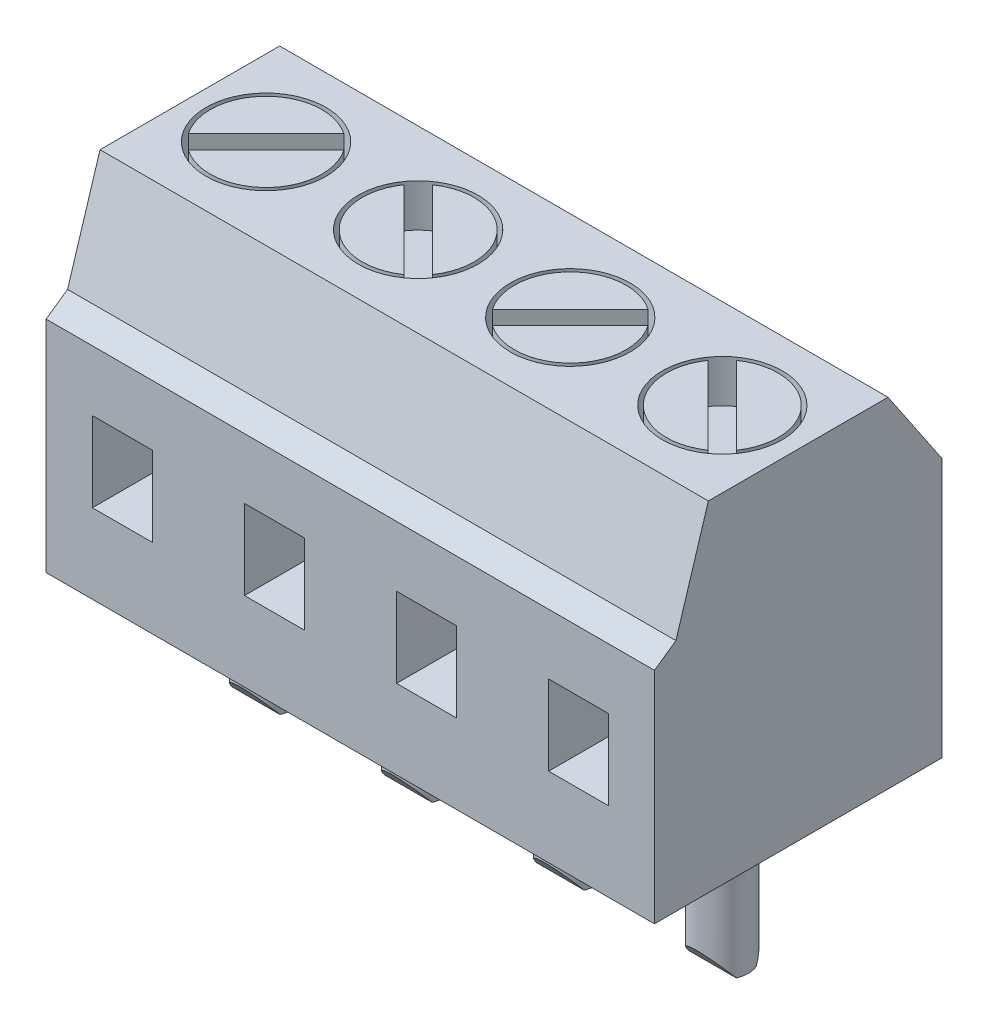
from build123d import *

# Parameters (mm, degrees)
SKETCH3_W                    = 15.24
SKETCH3_H                    = 7.2
BOSS_EXTRUDE1_DEPTH          = 8.5
SKETCH4_R                    = 0.65
BOSS_EXTRUDE2_DEPTH          = 3.5
CUT_EXTRUDE1_REACH           = 20.877
CUT_EXTRUDE3_DEPTH           = 15.24
SKETCH13_W                   = 1.5
SKETCH13_H                   = 2
CUT_EXTRUDE4_DEPTH           = 2
CUT_EXTRUDE4_DRAFT           = -6
CUT_EXTRUDE4_PROFILE_2_DEPTH = 2
CUT_EXTRUDE4_PROFILE_2_DRAFT = -6
CUT_EXTRUDE4_PROFILE_3_DEPTH = 2
CUT_EXTRUDE4_PROFILE_3_DRAFT = -6
CUT_EXTRUDE4_PROFILE_4_DEPTH = 2
CUT_EXTRUDE4_PROFILE_4_DRAFT = -6
SKETCH14_R                   = 1.5
SKETCH14_R_2                 = 1.4
CUT_EXTRUDE5_DEPTH           = 2
CUT_EXTRUDE6_DEPTH           = 1


with BuildPart() as part:
    # Sketch3 → Boss-Extrude1 (new body)
    with BuildSketch(Plane(origin=(0, 0, 0), x_dir=(1, 0, 0), z_dir=(0, 1, 0))):
        with Locations((7.62, 3.6)):
            Rectangle(SKETCH3_W, SKETCH3_H)
    extrude(amount=BOSS_EXTRUDE1_DEPTH)

    # Sketch4 → Boss-Extrude2 (add)
    with BuildSketch(Plane(origin=(0, 0, 0), x_dir=(-1, 0, 0), z_dir=(0, -1, 0))):
        with Locations(Location((-1.91, 3.6, 0), (0, 0, 90))):
            Circle(SKETCH4_R)
        with Locations(Location((-5.72, 3.6, 0), (0, 0, 90))):
            Circle(SKETCH4_R)
        with Locations(Location((-9.53, 3.6, 0), (0, 0, 90))):
            Circle(SKETCH4_R)
        with Locations(Location((-13.34, 3.6, 0), (0, 0, 90))):
            Circle(SKETCH4_R)
    extrude(amount=BOSS_EXTRUDE2_DEPTH)

    # Cut-Extrude1: up to this face of the body (flat: up to its plane)
    cut_extrude1_end = Plane(part.part.faces().sort_by_distance((15.24, 4.25, -3.6))[0])
    # Sketch5 → Cut-Extrude1 (cut, up to the picked face)
    with BuildSketch(Plane.ZY, mode=Mode.PRIVATE) as cut_extrude1_sk1:
        Polygon((-2.95, -3), (-2.95, -3.5), (-3.35, -3.5), align=None)
    cut_extrude1_tool1 = split(extrude(cut_extrude1_sk1.sketch, amount=-CUT_EXTRUDE1_REACH, mode=Mode.PRIVATE), bisect_by=cut_extrude1_end, keep=Keep.BOTH, mode=Mode.PRIVATE)
    # Sketch5 → Cut-Extrude1 (cut, up to the picked face)
    with BuildSketch(Plane.ZY, mode=Mode.PRIVATE) as cut_extrude1_sk2:
        Polygon((-4.25, -3), (-3.85, -3.5), (-4.25, -3.5), align=None)
    cut_extrude1_tool2 = split(extrude(cut_extrude1_sk2.sketch, amount=-CUT_EXTRUDE1_REACH, mode=Mode.PRIVATE), bisect_by=cut_extrude1_end, keep=Keep.BOTH, mode=Mode.PRIVATE)
    add(cut_extrude1_tool1.solids().sort_by(Axis((0, -3.333333, -3.083333), (1, 0, 0)))[0], mode=Mode.SUBTRACT)
    add(cut_extrude1_tool2.solids().sort_by(Axis((0, -3.333333, -4.116667), (1, 0, 0)))[0], mode=Mode.SUBTRACT)

    # Sketch8 → Cut-Extrude3 (cut)
    with BuildSketch(Plane(origin=(15.24, 0, 0), x_dir=(0, 0, -1), z_dir=(1, 0, 0))):
        Polygon((0, 5.5), (0.537301365, 5.876222466), (1.35, 8.5), (0, 8.5), align=None)
        Polygon((7.2, 6.5), (5.85, 8.5), (7.2, 8.5), align=None)
    extrude(amount=-CUT_EXTRUDE3_DEPTH, mode=Mode.SUBTRACT)


with BuildPart() as cut_extrude4_tool:
    # Sketch13 → Cut-Extrude4 (with draft: the straight prism first)
    with BuildSketch(Plane.XY):
        with Locations((13.34, 2.98672158)):
            Rectangle(SKETCH13_W, SKETCH13_H)
    extrude(amount=-CUT_EXTRUDE4_DEPTH)
    # Cut-Extrude4: the draft: its side faces are tilted about the plane it starts from
    cut_extrude4_sides = [cut_extrude4_tool.faces().sort_by_distance(p)[0] for p in [
        (13.34, 1.98672158, -1),
        (14.09, 2.98672158, -1),
        (13.34, 3.98672158, -1),
        (12.59, 2.98672158, -1),
    ]]
    draft(cut_extrude4_sides, Plane.XY, CUT_EXTRUDE4_DRAFT)


with BuildPart() as part_1:
    add(part.part)

    # Cut-Extrude4: cut by cut_extrude4_tool
    add(cut_extrude4_tool.part, mode=Mode.SUBTRACT)


with BuildPart() as cut_extrude4_profile_2_tool:
    # Sketch13 → Cut-Extrude4 profile 2 (with draft: the straight prism first)
    with BuildSketch(Plane.XY):
        with Locations((9.53, 2.98672158)):
            Rectangle(SKETCH13_W, SKETCH13_H)
    extrude(amount=-CUT_EXTRUDE4_PROFILE_2_DEPTH)
    # Cut-Extrude4 profile 2: the draft: its side faces are tilted about the plane it starts from
    cut_extrude4_profile_2_sides = [cut_extrude4_profile_2_tool.faces().sort_by_distance(p)[0] for p in [
        (9.53, 1.98672158, -1),
        (10.28, 2.98672158, -1),
        (9.53, 3.98672158, -1),
        (8.78, 2.98672158, -1),
    ]]
    draft(cut_extrude4_profile_2_sides, Plane.XY, CUT_EXTRUDE4_PROFILE_2_DRAFT)


with BuildPart() as part_2:
    add(part_1.part)

    # Cut-Extrude4 profile 2: cut by cut_extrude4_profile_2_tool
    add(cut_extrude4_profile_2_tool.part, mode=Mode.SUBTRACT)


with BuildPart() as cut_extrude4_profile_3_tool:
    # Sketch13 → Cut-Extrude4 profile 3 (with draft: the straight prism first)
    with BuildSketch(Plane.XY):
        with Locations((5.72, 2.98672158)):
            Rectangle(SKETCH13_W, SKETCH13_H)
    extrude(amount=-CUT_EXTRUDE4_PROFILE_3_DEPTH)
    # Cut-Extrude4 profile 3: the draft: its side faces are tilted about the plane it starts from
    cut_extrude4_profile_3_sides = [cut_extrude4_profile_3_tool.faces().sort_by_distance(p)[0] for p in [
        (5.72, 1.98672158, -1),
        (6.47, 2.98672158, -1),
        (5.72, 3.98672158, -1),
        (4.97, 2.98672158, -1),
    ]]
    draft(cut_extrude4_profile_3_sides, Plane.XY, CUT_EXTRUDE4_PROFILE_3_DRAFT)


with BuildPart() as part_3:
    add(part_2.part)

    # Cut-Extrude4 profile 3: cut by cut_extrude4_profile_3_tool
    add(cut_extrude4_profile_3_tool.part, mode=Mode.SUBTRACT)


with BuildPart() as cut_extrude4_profile_4_tool:
    # Sketch13 → Cut-Extrude4 profile 4 (with draft: the straight prism first)
    with BuildSketch(Plane.XY):
        with Locations((1.91, 2.98672158)):
            Rectangle(SKETCH13_W, SKETCH13_H)
    extrude(amount=-CUT_EXTRUDE4_PROFILE_4_DEPTH)
    # Cut-Extrude4 profile 4: the draft: its side faces are tilted about the plane it starts from
    cut_extrude4_profile_4_sides = [cut_extrude4_profile_4_tool.faces().sort_by_distance(p)[0] for p in [
        (1.91, 1.98672158, -1),
        (2.66, 2.98672158, -1),
        (1.91, 3.98672158, -1),
        (1.16, 2.98672158, -1),
    ]]
    draft(cut_extrude4_profile_4_sides, Plane.XY, CUT_EXTRUDE4_PROFILE_4_DRAFT)


with BuildPart() as part_4:
    add(part_3.part)

    # Cut-Extrude4 profile 4: cut by cut_extrude4_profile_4_tool
    add(cut_extrude4_profile_4_tool.part, mode=Mode.SUBTRACT)

    # Sketch14 → Cut-Extrude5 (cut)
    # profile 1 of 4: a face of its own
    with BuildSketch(Plane(origin=(0, 8.5, 0), x_dir=(1, 0, 0), z_dir=(0, 1, 0))):
        with Locations(Location((1.91, 3.6, 0), (0, 0, 270))):
            Circle(SKETCH14_R)
        with Locations(Location((1.91, 3.6, 0), (0, 0, 270))):
            Circle(SKETCH14_R_2, mode=Mode.SUBTRACT)
    # profile 2 of 4: a face of its own
    with BuildSketch(Plane(origin=(0, 8.5, 0), x_dir=(1, 0, 0), z_dir=(0, 1, 0))):
        with Locations(Location((5.72, 3.6, 0), (0, 0, 270))):
            Circle(SKETCH14_R)
        with Locations(Location((5.72, 3.6, 0), (0, 0, 270))):
            Circle(SKETCH14_R_2, mode=Mode.SUBTRACT)
    # profile 3 of 4: a face of its own
    with BuildSketch(Plane(origin=(0, 8.5, 0), x_dir=(1, 0, 0), z_dir=(0, 1, 0))):
        with Locations(Location((9.53, 3.6, 0), (0, 0, 270))):
            Circle(SKETCH14_R)
        with Locations(Location((9.53, 3.6, 0), (0, 0, 270))):
            Circle(SKETCH14_R_2, mode=Mode.SUBTRACT)
    # profile 4 of 4: a face of its own
    with BuildSketch(Plane(origin=(0, 8.5, 0), x_dir=(1, 0, 0), z_dir=(0, 1, 0))):
        with Locations(Location((13.34, 3.6, 0), (0, 0, 270))):
            Circle(SKETCH14_R)
        with Locations(Location((13.34, 3.6, 0), (0, 0, 270))):
            Circle(SKETCH14_R_2, mode=Mode.SUBTRACT)
    extrude(amount=-CUT_EXTRUDE5_DEPTH, mode=Mode.SUBTRACT)

    # Sketch15 → Cut-Extrude6 (cut)
    with BuildSketch(Plane(origin=(0, 8.5, 0), x_dir=(1, 0, 0), z_dir=(0, 1, 0))):
        with BuildLine():
            Line((1.102525711, 2.43897232), (3.07102768, 4.407474289))
            ThreePointArc((3.07102768, 4.407474289), (2.91, 4.6), (2.717474289, 4.76102768))
            Line((2.717474289, 4.76102768), (0.74897232, 2.792525711))
            ThreePointArc((0.74897232, 2.792525711), (0.91, 2.6), (1.102525711, 2.43897232))
        make_face()
        with BuildLine():
            Line((8.732738708, 2.449185318), (10.680814682, 4.397261292))
            ThreePointArc((10.680814682, 4.397261292), (10.519949494, 4.589949494), (10.327261292, 4.750814682))
            Line((10.327261292, 4.750814682), (8.379185318, 2.802738708))
            ThreePointArc((8.379185318, 2.802738708), (8.540050506, 2.610050506), (8.732738708, 2.449185318))
        make_face()
        with BuildLine():
            Line((6.870814682, 2.802738708), (4.922738708, 4.750814682))
            ThreePointArc((4.922738708, 4.750814682), (4.730050506, 4.589949494), (4.569185318, 4.397261292))
            Line((4.569185318, 4.397261292), (6.517261292, 2.449185318))
            ThreePointArc((6.517261292, 2.449185318), (6.709949494, 2.610050506), (6.870814682, 2.802738708))
        make_face()
        with BuildLine():
            Line((14.490814682, 2.802738708), (12.542738708, 4.750814682))
            ThreePointArc((12.542738708, 4.750814682), (12.350050506, 4.589949494), (12.189185318, 4.397261292))
            Line((12.189185318, 4.397261292), (14.137261292, 2.449185318))
            ThreePointArc((14.137261292, 2.449185318), (14.329949494, 2.610050506), (14.490814682, 2.802738708))
        make_face()
    extrude(amount=-CUT_EXTRUDE6_DEPTH, mode=Mode.SUBTRACT)


solid = part_4.part
